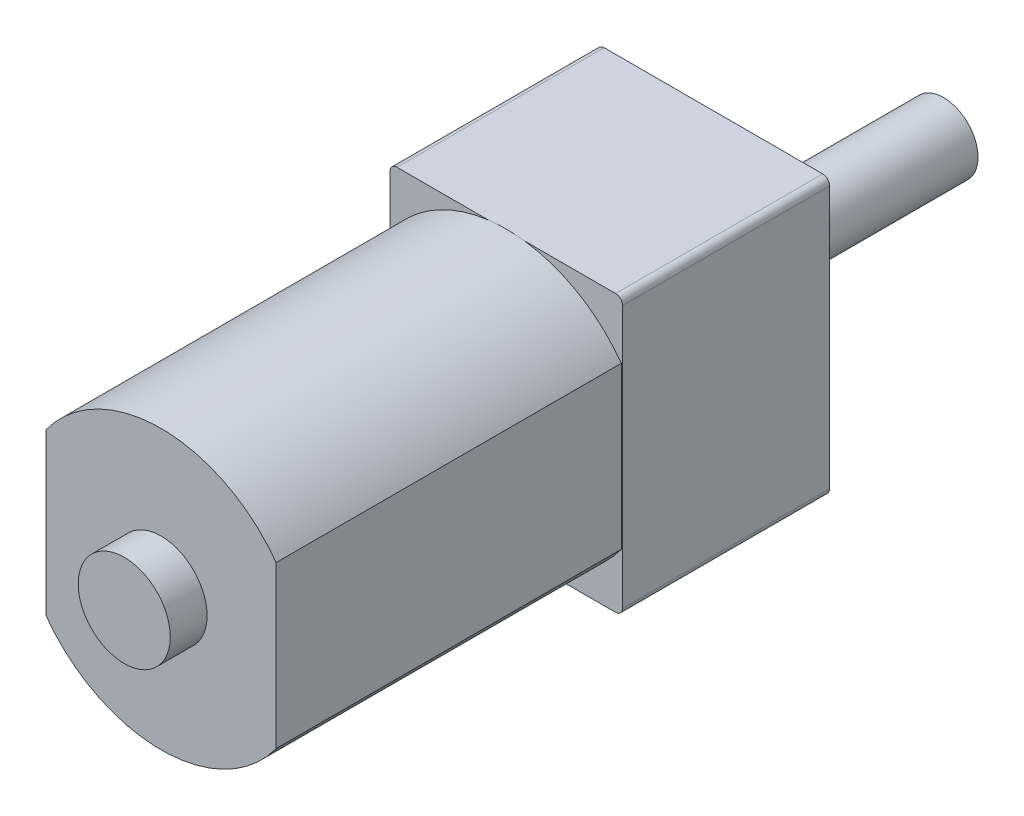
from build123d import *

# Parameters (mm, degrees)
BOSS_EXTRU_1_DEPTH = 15
ESQUISSE2_W        = 10.1
ESQUISSE2_H        = 12
BOSS_EXTRU_2_DEPTH = 9
BOSS_EXTRU_3_DEPTH = 10
ESQUISSE4_R        = 2
BOSS_EXTRU_4_DEPTH = 1
BOSS_EXTRU_5_START = 1.6
ESQUISSE5_R        = 2
BOSS_EXTRU_5_DEPTH = 1.6
CONG_1_R           = 0.3


with BuildPart() as part:
    # Esquisse1 → Boss.-Extru.1 (new body)
    with BuildSketch(Plane.XY):
        with BuildLine():
            Line((5, -3.5), (5, 3.5))
            ThreePointArc((5, 3.5), (0, 6.05), (-5, 3.5))
            Line((-5, 3.5), (-5, -3.5))
            ThreePointArc((-5, -3.5), (0, -6.05), (5, -3.5))
        make_face()
    extrude(amount=BOSS_EXTRU_1_DEPTH)

    # Esquisse2 → Boss.-Extru.2 (add)
    with BuildSketch(Plane(origin=(0, 0, 0), x_dir=(-1, 0, 0), z_dir=(0, 0, -1))):
        Rectangle(ESQUISSE2_W, ESQUISSE2_H)
    extrude(amount=BOSS_EXTRU_2_DEPTH)

    # Esquisse3 → Boss.-Extru.3 (add)
    with BuildSketch(Plane(origin=(0, 0, -9), x_dir=(-1, 0, 0), z_dir=(0, 0, -1))):
        with BuildLine():
            Line((1, -1.118033989), (1, 1.118033989))
            ThreePointArc((1, 1.118033989), (-1.5, 0), (1, -1.118033989))
        make_face()
    extrude(amount=BOSS_EXTRU_3_DEPTH)

    # Esquisse4 → Boss.-Extru.4 (add)
    with BuildSketch(Plane(origin=(0, 0, -9), x_dir=(-1, 0, 0), z_dir=(0, 0, -1))):
        Circle(ESQUISSE4_R)
    extrude(amount=BOSS_EXTRU_4_DEPTH)

    # Esquisse5 → Boss.-Extru.5 (add)
    with BuildSketch(Plane.XY.offset(15).offset(BOSS_EXTRU_5_START)):
        with Locations(Location((0, 0, 0), (0, 0, 180))):
            Circle(ESQUISSE5_R)
    extrude(amount=-BOSS_EXTRU_5_DEPTH)

    # Congé1
    cong_1_edges = [part.edges().sort_by_distance(p)[0] for p in [
        (5.05, 6, -4.5),
        (5.05, -6, -4.5),
        (-5.05, -6, -4.5),
        (-5.05, 6, -4.5),
    ]]
    fillet(cong_1_edges, radius=CONG_1_R)


solid = part.part
